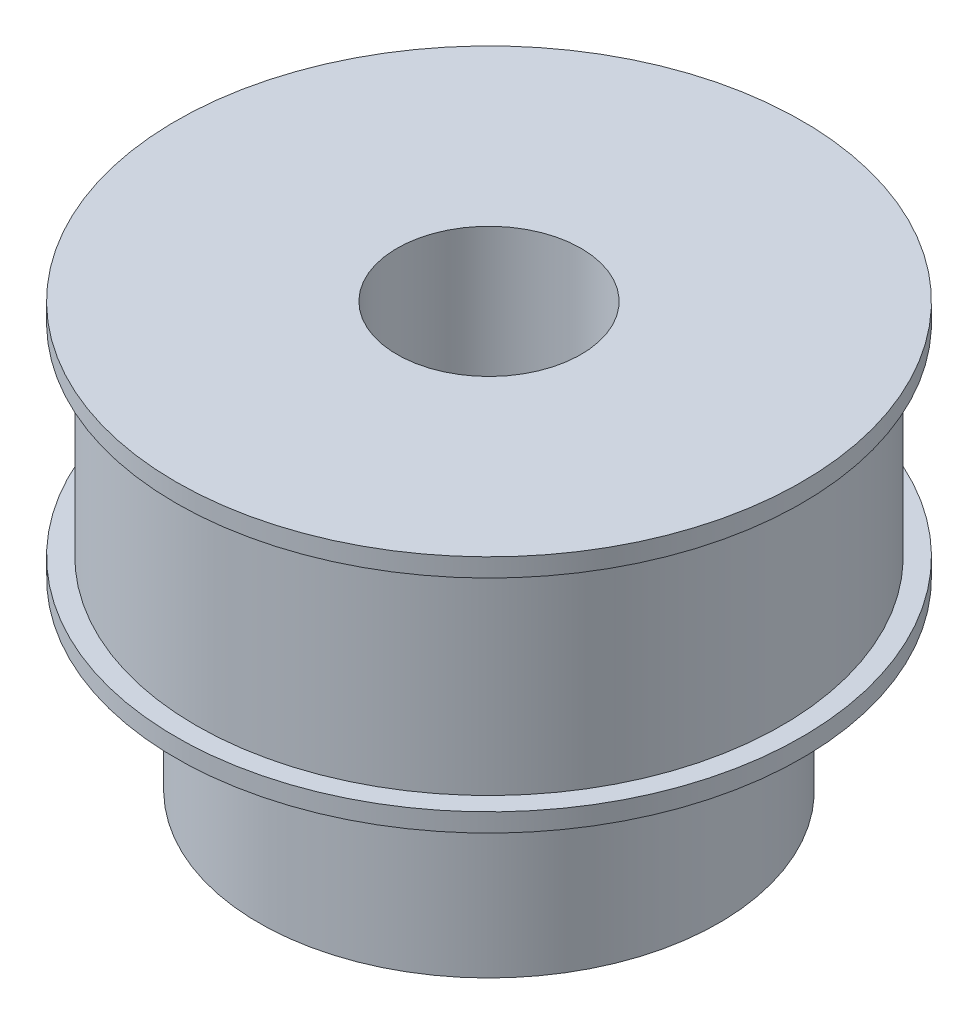
from build123d import *

# Parameters (mm, degrees)
SKETCH_1_R          = 15.915
EXTRUDE_1_DEPTH     = 11
SKETCH_2_R          = 17
EXTRUDE_2_DEPTH     = 1
EXTRUDE_START       = 1
SKETCH_3_R          = 17
EXTRUDE_3_DEPTH     = 1
SKETCH_4_R          = 5
CUT_EXTRUDE_1_DEPTH = 28.331300737
EXTRUDE_START_2     = 10
SKETCH_5_R          = 12.5
SKETCH_5_R_2        = 5
EXTRUDE_4_DEPTH     = 10


with BuildPart() as part:
    # 草图1 → 凸台-拉伸1 (new body)
    with BuildSketch(Plane(origin=(0, 0, 0), x_dir=(1, 0, 0), z_dir=(0, 1, 0))):
        with Locations(Location((0, 0, 0), (0, 0, 270))):
            Circle(SKETCH_1_R)
    extrude(amount=EXTRUDE_1_DEPTH)

    # 草图2 → 凸台-拉伸2 (add)
    with BuildSketch(Plane(origin=(0, 11, 0), x_dir=(1, 0, 0), z_dir=(0, 1, 0))):
        with Locations(Location((0, 0, 0), (0, 0, 270))):
            Circle(SKETCH_2_R)
    extrude(amount=EXTRUDE_2_DEPTH)

    # 草图3 → 凸台-拉伸3 (add)
    with BuildSketch(Plane.XZ.offset(EXTRUDE_START)):
        with Locations(Location((0, 0, 0), (0, 0, 90))):
            Circle(SKETCH_3_R)
    extrude(amount=-EXTRUDE_3_DEPTH)

    # 草图4 → 切除-拉伸1 (cut, through all)
    with BuildSketch(Plane.XZ.offset(1)):
        with Locations(Location((0, 0, 0), (0, 0, 270))):
            Circle(SKETCH_4_R)
    extrude(amount=-CUT_EXTRUDE_1_DEPTH, mode=Mode.SUBTRACT)

    # 草图5 → 凸台-拉伸4 (add)
    with BuildSketch(Plane.XZ.offset(1).offset(EXTRUDE_START_2)):
        with Locations(Location((0, 0, 0), (0, 0, 270))):
            Circle(SKETCH_5_R)
        with Locations(Location((0, 0, 0), (0, 0, 270))):
            Circle(SKETCH_5_R_2, mode=Mode.SUBTRACT)
    extrude(amount=-EXTRUDE_4_DEPTH)


solid = part.part
